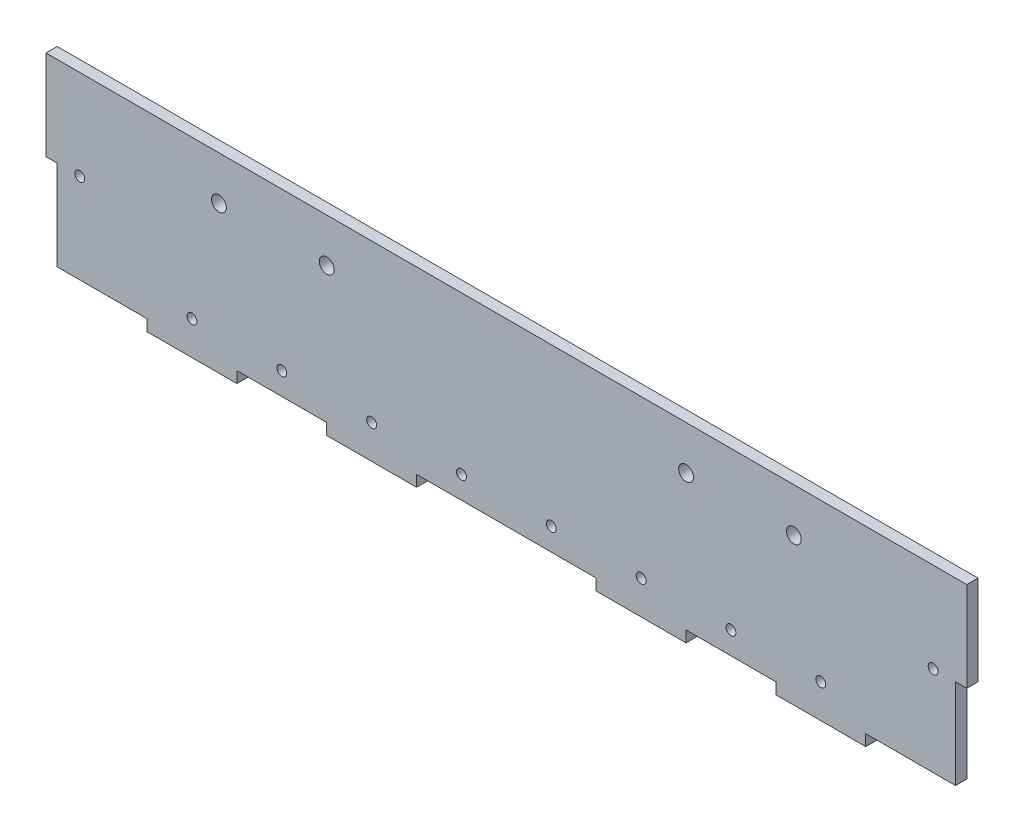
from build123d import *

# Parameters (mm, degrees)
SKETCH_1_R          = 2.2
EXTRUDE_1_DEPTH     = 5
SKETCH_2_W          = 410
SKETCH_2_H          = 226.105378696
CUT_EXTRUDE_2_DEPTH = 5
SKETCH_4_W          = 410
SKETCH_4_H          = 19.486670542
EXTRUDE_3_DEPTH     = 5
SKETCH_5_R          = 3.3
CUT_EXTRUDE_3_DEPTH = 10


with BuildPart() as part:
    # 草图1 → 凸台-拉伸1 (new body)
    with BuildSketch(Plane.XY):
        Polygon((-200, 150), (200, 150), (200, 110), (205, 110), (205, 70), (200, 70), (200, 30), (205, 30), (205, -30), (200, -30), (200, -70), (205, -70), (205, -110), (200, -110), (200, -150), (160, -150), (160, -155), (120, -155), (120, -150), (80, -150), (80, -155), (40, -155), (40, -150), (-40, -150), (-40, -155), (-80, -155), (-80, -150), (-120, -150), (-120, -155), (-160, -155), (-160, -150), (-200, -150), (-200, -110), (-205, -110), (-205, -70), (-200, -70), (-200, -30), (-205, -30), (-205, 30), (-200, 30), (-200, 70), (-205, 70), (-205, 110), (-200, 110), align=None)
        with Locations((-140, -140)):
            Circle(SKETCH_1_R, mode=Mode.SUBTRACT)
        with Locations((-100, -140)):
            Circle(SKETCH_1_R, mode=Mode.SUBTRACT)
        with Locations((-60, -140)):
            Circle(SKETCH_1_R, mode=Mode.SUBTRACT)
        with Locations((-20, -140)):
            Circle(SKETCH_1_R, mode=Mode.SUBTRACT)
        with Locations((20, -140)):
            Circle(SKETCH_1_R, mode=Mode.SUBTRACT)
        with Locations((60, -140)):
            Circle(SKETCH_1_R, mode=Mode.SUBTRACT)
        with Locations((100, -140)):
            Circle(SKETCH_1_R, mode=Mode.SUBTRACT)
        with Locations((140, -140)):
            Circle(SKETCH_1_R, mode=Mode.SUBTRACT)
        with Locations((-190, 110)):
            Circle(SKETCH_1_R, mode=Mode.SUBTRACT)
        with Locations((-190, 70)):
            Circle(SKETCH_1_R, mode=Mode.SUBTRACT)
        with Locations((-190, 30)):
            Circle(SKETCH_1_R, mode=Mode.SUBTRACT)
        with Locations((-190, -30)):
            Circle(SKETCH_1_R, mode=Mode.SUBTRACT)
        with Locations((-190, -70)):
            Circle(SKETCH_1_R, mode=Mode.SUBTRACT)
        with Locations((-190, -110)):
            Circle(SKETCH_1_R, mode=Mode.SUBTRACT)
        with Locations((190, -110)):
            Circle(SKETCH_1_R, mode=Mode.SUBTRACT)
        with Locations((190, -70)):
            Circle(SKETCH_1_R, mode=Mode.SUBTRACT)
        with Locations((190, -30)):
            Circle(SKETCH_1_R, mode=Mode.SUBTRACT)
        with Locations((190, 30)):
            Circle(SKETCH_1_R, mode=Mode.SUBTRACT)
        with Locations((190, 70)):
            Circle(SKETCH_1_R, mode=Mode.SUBTRACT)
        with Locations((190, 110)):
            Circle(SKETCH_1_R, mode=Mode.SUBTRACT)
    extrude(amount=EXTRUDE_1_DEPTH)

    # 草图2 → 切除-拉伸2 (cut)
    with BuildSketch(Plane.XY.offset(5)):
        with Locations((0, 43.052689348)):
            Rectangle(SKETCH_2_W, SKETCH_2_H)
    extrude(amount=-CUT_EXTRUDE_2_DEPTH, mode=Mode.SUBTRACT)

    # 草图4 → 凸台-拉伸3 (add)
    with BuildSketch(Plane.XY.offset(5)):
        with Locations((0, -79.743335271)):
            Rectangle(SKETCH_4_W, SKETCH_4_H)
    extrude(amount=-EXTRUDE_3_DEPTH)

    # 草图5 → 切除-拉伸3 (cut)
    with BuildSketch(Plane(origin=(0, 0, 0), x_dir=(-1, 0, 0), z_dir=(0, 0, -1))):
        with Locations((-80, -89.5)):
            Circle(SKETCH_5_R)
        with Locations((-128, -89.5)):
            Circle(SKETCH_5_R)
        with Locations(Location((128, -89.5, 0), (0, 0, 180))):
            Circle(SKETCH_5_R)
        with Locations(Location((80, -89.5, 0), (0, 0, 180))):
            Circle(SKETCH_5_R)
    extrude(amount=-CUT_EXTRUDE_3_DEPTH, mode=Mode.SUBTRACT)


solid = part.part
